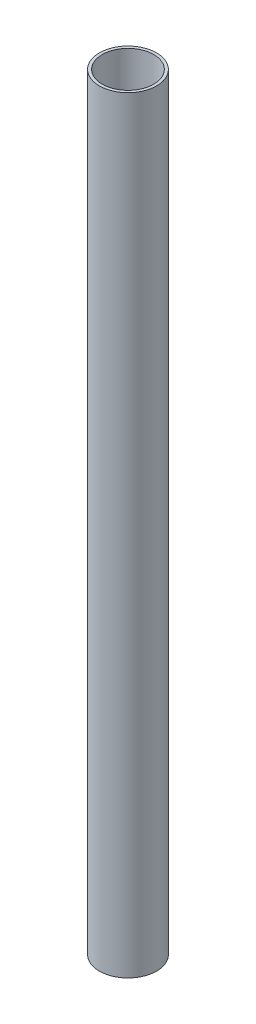
from build123d import *

# Parameters (mm, degrees)
SKETCH1_R           = 10
SKETCH1_R_2         = 9
BOSS_EXTRUDE1_DEPTH = 268


with BuildPart() as part:
    # Sketch1 → Boss-Extrude1 (new body)
    with BuildSketch(Plane(origin=(0, 0, 0), x_dir=(1, 0, 0), z_dir=(0, 1, 0))):
        with Locations(Location((0, 0, 0), (0, 0, 270))):
            Circle(SKETCH1_R)
        with Locations(Location((0, 0, 0), (0, 0, 270))):
            Circle(SKETCH1_R_2, mode=Mode.SUBTRACT)
    extrude(amount=BOSS_EXTRUDE1_DEPTH)


solid = part.part
